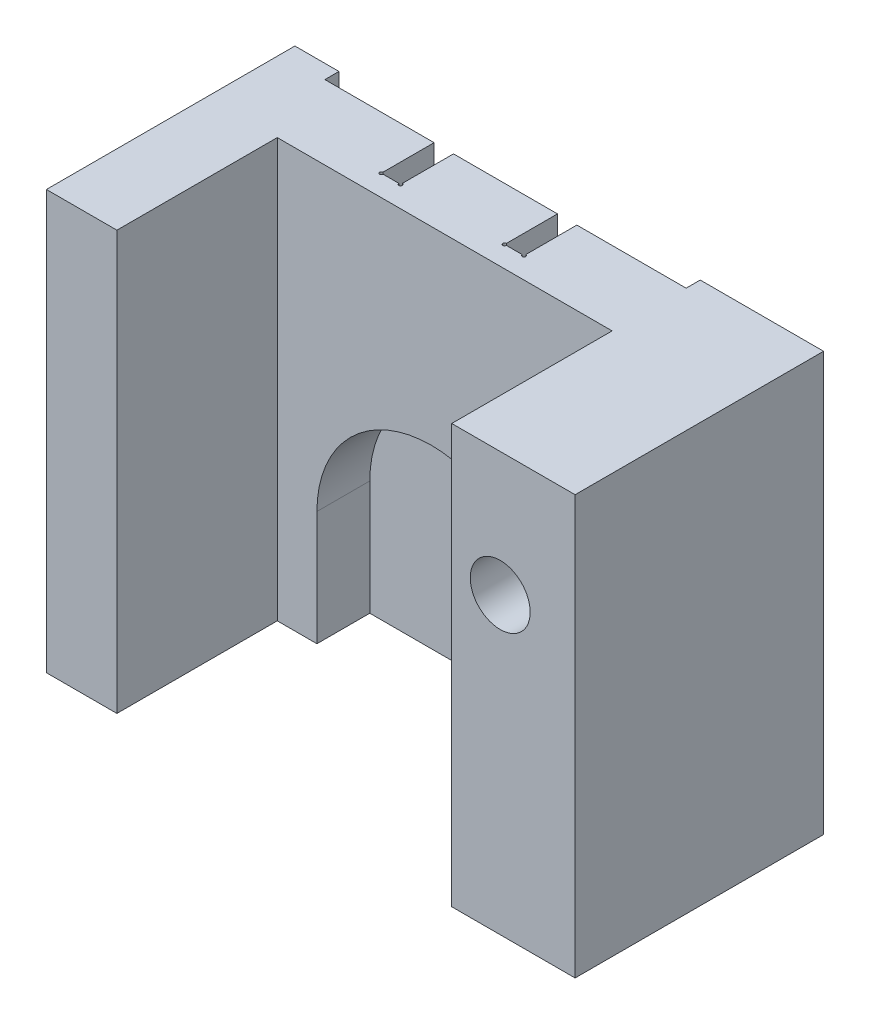
from build123d import *

# Parameters (mm, degrees)
SKETCH_1_W          = 30
SKETCH_1_H          = 28
EXTRUDE_1_DEPTH     = 10
CUT_EXTRUDE_2_DEPTH = 0.8
M1_4X0_3_2_D        = 1.1
M1_4X0_3_2_DEPTH    = 3.7
M1_4X0_3_2_TIP      = 0.33047334
CUT_EXTRUDE_3_DEPTH = 4
CUT_EXTRUDE_4_DEPTH = 0.5
SKETCH_12_W         = 30
SKETCH_12_H         = 4.25
CUT_EXTRUDE_5_DEPTH = 10
SKETCH_13_R         = 1.7
CUT_EXTRUDE_6_DEPTH = 10
SKETCH_14_W         = 23
SKETCH_14_H         = 23.75
CUT_EXTRUDE_7_DEPTH = 5
CUT_EXTRUDE_9_DEPTH = 3
SKETCH_20_W         = 7
SKETCH_20_H         = 23.75
SKETCH_20_R         = 1.7
EXTRUDE_3_DEPTH     = 4.1
SKETCH_23_W         = 4
SKETCH_23_H         = 23.75
EXTRUDE_4_DEPTH     = 9.1


with BuildPart() as part:
    # 草图1 → 凸台-拉伸1 (new body)
    with BuildSketch(Plane.XY):
        with Locations((7.449728974, 2.736434109)):
            Rectangle(SKETCH_1_W, SKETCH_1_H)
    extrude(amount=EXTRUDE_1_DEPTH)

    # 草图2 → 切除-拉伸2 (cut)
    with BuildSketch(Plane(origin=(0, 0, 0), x_dir=(-1, 0, 0), z_dir=(0, 0, -1))):
        with BuildLine():
            Line((5.050271026, 16.736434109), (-15.449728974, 16.736434109))
            Line((-15.449728974, 16.736434109), (-15.449728974, 3.736434109))
            ThreePointArc((-15.449728974, 3.736434109), (-14.571049317, 1.615113765), (-12.449728974, 0.736434109))
            Line((-12.449728974, 0.736434109), (2.050271026, 0.736434109))
            ThreePointArc((2.050271026, 0.736434109), (4.17159137, 1.615113765), (5.050271026, 3.736434109))
            Line((5.050271026, 3.736434109), (5.050271026, 16.736434109))
        make_face()
    extrude(amount=-CUT_EXTRUDE_2_DEPTH, mode=Mode.SUBTRACT)

    # M1.4x0.3 螺纹孔2
    with Locations(Plane(origin=(0, 0, 0.8), x_dir=(-1, 0, 0), z_dir=(0, 0, -1))):
        with Locations((-12.199728974, 8.736434109), (1.800271026, 8.736434109)):
            Hole(M1_4X0_3_2_D / 2, depth=M1_4X0_3_2_DEPTH)
            with Locations((0, 0, -(M1_4X0_3_2_DEPTH + M1_4X0_3_2_TIP / 2))):  # 118° drill point
                Cone(0, M1_4X0_3_2_D / 2, M1_4X0_3_2_TIP, mode=Mode.SUBTRACT)

    # 草图10 → 切除-拉伸3 (cut)
    with BuildSketch(Plane(origin=(0, 16.736434109, 0), x_dir=(1, 0, 0), z_dir=(0, 1, 0))):
        with BuildLine():
            Line((9.249728974, -0.8), (8.149728974, -0.8))
            Line((8.149728974, -0.8), (8.149728974, -3.7))
            ThreePointArc((8.149728974, -3.7), (8.07901805, -3.870710433), (8.249728974, -3.800000693))
            Line((8.249728974, -3.800000693), (9.14947862, -3.800000693))
            ThreePointArc((9.14947862, -3.800000693), (9.320100726, -3.870799843), (9.249728974, -3.700001016))
            Line((9.249728974, -3.700001016), (9.249728974, -0.8))
        make_face()
        with BuildLine():
            Line((1.149728974, -0.8), (2.249728974, -0.8))
            Line((2.249728974, -0.8), (2.249728974, -3.696415438))
            ThreePointArc((2.249728974, -3.696415438), (2.32297432, -3.873245346), (2.146144411, -3.8))
            Line((2.146144411, -3.8), (1.245429293, -3.8))
            ThreePointArc((1.245429293, -3.8), (1.082058629, -3.867670345), (1.149728974, -3.704299681))
            Line((1.149728974, -3.704299681), (1.149728974, -0.8))
        make_face()
    extrude(amount=-CUT_EXTRUDE_3_DEPTH, mode=Mode.SUBTRACT)

    # 草图11 → 切除-拉伸4 (cut)
    with BuildSketch(Plane(origin=(0, 0, 0), x_dir=(-1, 0, 0), z_dir=(0, 0, -1))):
        with BuildLine():
            Line((-7.549728974, -2.063565891), (-2.849728974, -2.063565891))
            ThreePointArc((-2.849728974, -2.063565891), (-2.422952278, -2.240342587), (-2.599728974, -1.813565891))
            Line((-2.599728974, -1.813565891), (-2.599728974, 0.736434109))
            Line((-2.599728974, 0.736434109), (-7.799728974, 0.736434109))
            Line((-7.799728974, 0.736434109), (-7.799728974, -1.813565891))
            ThreePointArc((-7.799728974, -1.813565891), (-7.976505669, -2.240342587), (-7.549728974, -2.063565891))
        make_face()
    extrude(amount=-CUT_EXTRUDE_4_DEPTH, mode=Mode.SUBTRACT)

    # 草图12 → 切除-拉伸5 (cut)
    with BuildSketch(Plane(origin=(0, 0, 0), x_dir=(-1, 0, 0), z_dir=(0, 0, -1))):
        with Locations((-7.449728974, -9.138565891)):
            Rectangle(SKETCH_12_W, SKETCH_12_H)
    extrude(amount=-CUT_EXTRUDE_5_DEPTH, mode=Mode.SUBTRACT)

    # 草图13 → 切除-拉伸6 (cut)
    with BuildSketch(Plane(origin=(0, 0, 0), x_dir=(-1, 0, 0), z_dir=(0, 0, -1))):
        with Locations((-18.199728974, 9.686434109)):
            Circle(SKETCH_13_R)
    extrude(amount=-CUT_EXTRUDE_6_DEPTH, mode=Mode.SUBTRACT)

    # 草图14 → 切除-拉伸7 (cut)
    with BuildSketch(Plane.XY.offset(10)):
        with Locations((3.949728974, 4.861434109)):
            Rectangle(SKETCH_14_W, SKETCH_14_H)
    extrude(amount=-CUT_EXTRUDE_7_DEPTH, mode=Mode.SUBTRACT)

    # 草图16 → 切除-拉伸9 (cut)
    with BuildSketch(Plane.XY.offset(5)):
        with BuildLine():
            Line((-1.300271026, -7.013565891), (11.699728974, -7.013565891))
            Line((11.699728974, -7.013565891), (11.699728974, -0.513565891))
            ThreePointArc((11.699728974, -0.513565891), (5.199728974, 5.986434109), (-1.300271026, -0.513565891))
            Line((-1.300271026, -0.513565891), (-1.300271026, -7.013565891))
        make_face()
    extrude(amount=-CUT_EXTRUDE_9_DEPTH, mode=Mode.SUBTRACT)

    # 草图20 → 凸台-拉伸3 (add)
    with BuildSketch(Plane.XY.offset(10)):
        with Locations((18.949728974, 4.861434109)):
            Rectangle(SKETCH_20_W, SKETCH_20_H)
        with Locations(Location((18.199728974, 9.686434109, 0), (0, 0, 180))):
            Circle(SKETCH_20_R, mode=Mode.SUBTRACT)
    extrude(amount=EXTRUDE_3_DEPTH)

    # 草图23 → 凸台-拉伸4 (add)
    with BuildSketch(Plane.XY.offset(5)):
        with Locations((-5.550271026, 4.861434109)):
            Rectangle(SKETCH_23_W, SKETCH_23_H)
    extrude(amount=EXTRUDE_4_DEPTH)


solid = part.part
